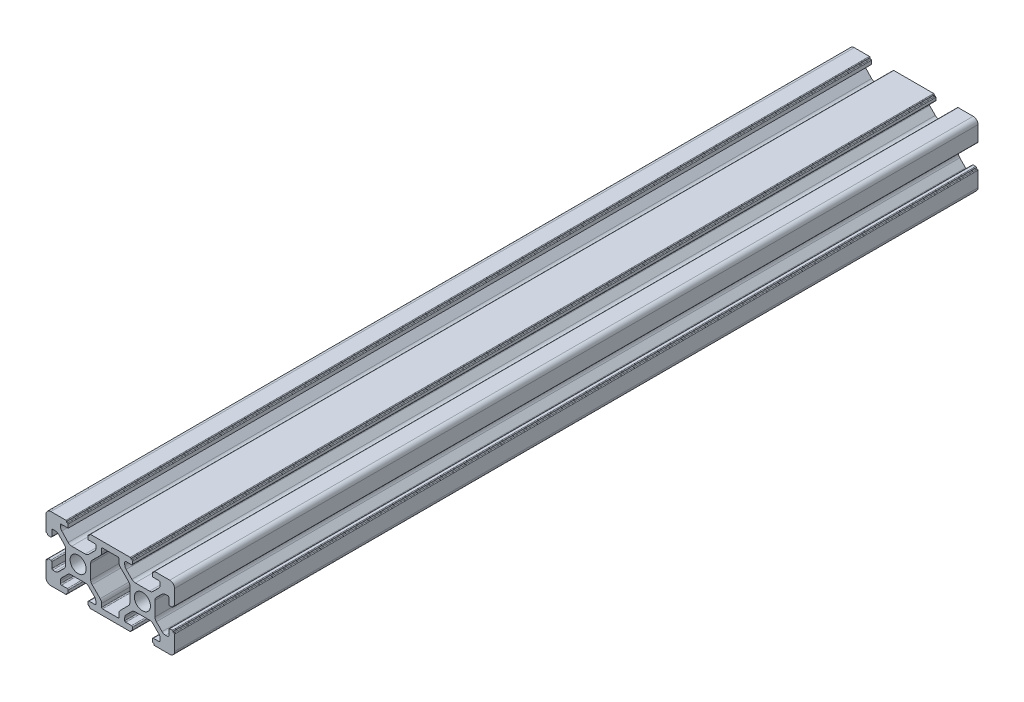
from build123d import *

# Parameters (mm, degrees)
SKETCH1_R           = 2.5
BOSS_EXTRUDE2_DEPTH = 250


with BuildPart() as part:
    # Sketch1 → Boss-Extrude2 (new body)
    with BuildSketch(Plane.XY):
        with BuildLine():
            Line((1.5, 0), (6.2, 0))
            ThreePointArc((6.2, 0), (6.341421356, 0.058578644), (6.4, 0.2))
            Line((6.4, 0.2), (6.4, 0.3))
            ThreePointArc((6.4, 0.3), (6.458578644, 0.441421356), (6.6, 0.5))
            Line((6.6, 0.5), (6.7, 0.5))
            ThreePointArc((6.7, 0.5), (6.841421356, 0.558578644), (6.9, 0.7))
            Line((6.9, 0.7), (6.9, 1.5))
            ThreePointArc((6.9, 1.5), (6.812132034, 1.712132034), (6.6, 1.8))
            Line((6.6, 1.8), (4.8, 1.8))
            ThreePointArc((4.8, 1.8), (4.587867966, 1.887867966), (4.5, 2.1))
            Line((4.5, 2.1), (4.5, 2.818019485))
            ThreePointArc((4.5, 2.818019485), (4.614180701, 3.392044633), (4.939339828, 3.878679656))
            Line((4.939339828, 3.878679656), (6.721320344, 5.660660172))
            ThreePointArc((6.721320344, 5.660660172), (7.207955367, 5.985819299), (7.781980515, 6.1))
            Line((7.781980515, 6.1), (12.218019485, 6.1))
            ThreePointArc((12.218019485, 6.1), (12.792044633, 5.985819299), (13.278679656, 5.660660172))
            Line((13.278679656, 5.660660172), (15.060660172, 3.878679656))
            ThreePointArc((15.060660172, 3.878679656), (15.385819299, 3.392044633), (15.5, 2.818019485))
            Line((15.5, 2.818019485), (15.5, 2.1))
            ThreePointArc((15.5, 2.1), (15.412132034, 1.887867966), (15.2, 1.8))
            Line((15.2, 1.8), (13.4, 1.8))
            ThreePointArc((13.4, 1.8), (13.187867966, 1.712132034), (13.1, 1.5))
            Line((13.1, 1.5), (13.1, 0.7))
            ThreePointArc((13.1, 0.7), (13.158578644, 0.558578644), (13.3, 0.5))
            Line((13.3, 0.5), (13.4, 0.5))
            ThreePointArc((13.4, 0.5), (13.541421356, 0.441421356), (13.6, 0.3))
            Line((13.6, 0.3), (13.6, 0.2))
            ThreePointArc((13.6, 0.2), (13.658578644, 0.058578644), (13.8, 0))
            Line((13.8, 0), (26.2, 0))
            ThreePointArc((26.2, 0), (26.341421356, 0.058578644), (26.4, 0.2))
            Line((26.4, 0.2), (26.4, 0.3))
            ThreePointArc((26.4, 0.3), (26.458578644, 0.441421356), (26.6, 0.5))
            Line((26.6, 0.5), (26.7, 0.5))
            ThreePointArc((26.7, 0.5), (26.841421356, 0.558578644), (26.9, 0.7))
            Line((26.9, 0.7), (26.9, 1.5))
            ThreePointArc((26.9, 1.5), (26.812132034, 1.712132034), (26.6, 1.8))
            Line((26.6, 1.8), (24.8, 1.8))
            ThreePointArc((24.8, 1.8), (24.587867966, 1.887867966), (24.5, 2.1))
            Line((24.5, 2.1), (24.5, 2.818019485))
            ThreePointArc((24.5, 2.818019485), (24.614180701, 3.392044633), (24.939339828, 3.878679656))
            Line((24.939339828, 3.878679656), (26.721320344, 5.660660172))
            ThreePointArc((26.721320344, 5.660660172), (27.207955367, 5.985819299), (27.781980515, 6.1))
            Line((27.781980515, 6.1), (32.218019485, 6.1))
            ThreePointArc((32.218019485, 6.1), (32.792044633, 5.985819299), (33.278679656, 5.660660172))
            Line((33.278679656, 5.660660172), (35.060660172, 3.878679656))
            ThreePointArc((35.060660172, 3.878679656), (35.385819299, 3.392044633), (35.5, 2.818019485))
            Line((35.5, 2.818019485), (35.5, 2.1))
            ThreePointArc((35.5, 2.1), (35.412132034, 1.887867966), (35.2, 1.8))
            Line((35.2, 1.8), (33.4, 1.8))
            ThreePointArc((33.4, 1.8), (33.187867966, 1.712132034), (33.1, 1.5))
            Line((33.1, 1.5), (33.1, 0.7))
            ThreePointArc((33.1, 0.7), (33.158578644, 0.558578644), (33.3, 0.5))
            Line((33.3, 0.5), (33.4, 0.5))
            ThreePointArc((33.4, 0.5), (33.541421356, 0.441421356), (33.6, 0.3))
            Line((33.6, 0.3), (33.6, 0.2))
            ThreePointArc((33.6, 0.2), (33.658578644, 0.058578644), (33.8, 0))
            Line((33.8, 0), (38.5, 0))
            ThreePointArc((38.5, 0), (39.560660172, 0.439339828), (40, 1.5))
            Line((40, 1.5), (40, 6.2))
            ThreePointArc((40, 6.2), (39.941421356, 6.341421356), (39.8, 6.4))
            Line((39.8, 6.4), (39.7, 6.4))
            ThreePointArc((39.7, 6.4), (39.558578644, 6.458578644), (39.5, 6.6))
            Line((39.5, 6.6), (39.5, 6.7))
            ThreePointArc((39.5, 6.7), (39.441421356, 6.841421356), (39.3, 6.9))
            Line((39.3, 6.9), (38.5, 6.9))
            ThreePointArc((38.5, 6.9), (38.287867966, 6.812132034), (38.2, 6.6))
            Line((38.2, 6.6), (38.2, 4.8))
            ThreePointArc((38.2, 4.8), (38.112132034, 4.587867966), (37.9, 4.5))
            Line((37.9, 4.5), (37.181980515, 4.5))
            ThreePointArc((37.181980515, 4.5), (36.607955367, 4.614180701), (36.121320344, 4.939339828))
            Line((36.121320344, 4.939339828), (34.339339828, 6.721320344))
            ThreePointArc((34.339339828, 6.721320344), (34.014180701, 7.207955367), (33.9, 7.781980515))
            Line((33.9, 7.781980515), (33.9, 12.218019485))
            ThreePointArc((33.9, 12.218019485), (34.014180701, 12.792044633), (34.339339828, 13.278679656))
            Line((34.339339828, 13.278679656), (36.121320344, 15.060660172))
            ThreePointArc((36.121320344, 15.060660172), (36.607955367, 15.385819299), (37.181980515, 15.5))
            Line((37.181980515, 15.5), (37.9, 15.5))
            ThreePointArc((37.9, 15.5), (38.112132034, 15.412132034), (38.2, 15.2))
            Line((38.2, 15.2), (38.2, 13.4))
            ThreePointArc((38.2, 13.4), (38.287867966, 13.187867966), (38.5, 13.1))
            Line((38.5, 13.1), (39.3, 13.1))
            ThreePointArc((39.3, 13.1), (39.441421356, 13.158578644), (39.5, 13.3))
            Line((39.5, 13.3), (39.5, 13.4))
            ThreePointArc((39.5, 13.4), (39.558578644, 13.541421356), (39.7, 13.6))
            Line((39.7, 13.6), (39.8, 13.6))
            ThreePointArc((39.8, 13.6), (39.941421356, 13.658578644), (40, 13.8))
            Line((40, 13.8), (40, 18.5))
            ThreePointArc((40, 18.5), (39.560660172, 19.560660172), (38.5, 20))
            Line((38.5, 20), (33.8, 20))
            ThreePointArc((33.8, 20), (33.658578644, 19.941421356), (33.6, 19.8))
            Line((33.6, 19.8), (33.6, 19.7))
            ThreePointArc((33.6, 19.7), (33.541421356, 19.558578644), (33.4, 19.5))
            Line((33.4, 19.5), (33.3, 19.5))
            ThreePointArc((33.3, 19.5), (33.158578644, 19.441421356), (33.1, 19.3))
            Line((33.1, 19.3), (33.1, 18.5))
            ThreePointArc((33.1, 18.5), (33.187867966, 18.287867966), (33.4, 18.2))
            Line((33.4, 18.2), (35.2, 18.2))
            ThreePointArc((35.2, 18.2), (35.412132034, 18.112132034), (35.5, 17.9))
            Line((35.5, 17.9), (35.5, 17.181980515))
            ThreePointArc((35.5, 17.181980515), (35.385819299, 16.607955367), (35.060660172, 16.121320344))
            Line((35.060660172, 16.121320344), (33.278679656, 14.339339828))
            ThreePointArc((33.278679656, 14.339339828), (32.792044633, 14.014180701), (32.218019485, 13.9))
            Line((32.218019485, 13.9), (27.781980515, 13.9))
            ThreePointArc((27.781980515, 13.9), (27.207955367, 14.014180701), (26.721320344, 14.339339828))
            Line((26.721320344, 14.339339828), (24.939339828, 16.121320344))
            ThreePointArc((24.939339828, 16.121320344), (24.614180701, 16.607955367), (24.5, 17.181980515))
            Line((24.5, 17.181980515), (24.5, 17.9))
            ThreePointArc((24.5, 17.9), (24.587867966, 18.112132034), (24.8, 18.2))
            Line((24.8, 18.2), (26.6, 18.2))
            ThreePointArc((26.6, 18.2), (26.812132034, 18.287867966), (26.9, 18.5))
            Line((26.9, 18.5), (26.9, 19.3))
            ThreePointArc((26.9, 19.3), (26.841421356, 19.441421356), (26.7, 19.5))
            Line((26.7, 19.5), (26.6, 19.5))
            ThreePointArc((26.6, 19.5), (26.458578644, 19.558578644), (26.4, 19.7))
            Line((26.4, 19.7), (26.4, 19.8))
            ThreePointArc((26.4, 19.8), (26.341421356, 19.941421356), (26.2, 20))
            Line((26.2, 20), (13.8, 20))
            ThreePointArc((13.8, 20), (13.658578644, 19.941421356), (13.6, 19.8))
            Line((13.6, 19.8), (13.6, 19.7))
            ThreePointArc((13.6, 19.7), (13.541421356, 19.558578644), (13.4, 19.5))
            Line((13.4, 19.5), (13.3, 19.5))
            ThreePointArc((13.3, 19.5), (13.158578644, 19.441421356), (13.1, 19.3))
            Line((13.1, 19.3), (13.1, 18.2))
            Line((13.1, 18.2), (15.3, 18.2))
            ThreePointArc((15.3, 18.2), (15.512132034, 18.112132034), (15.6, 17.9))
            Line((15.6, 17.9), (15.6, 17.281980515))
            ThreePointArc((15.6, 17.281980515), (15.485819299, 16.707955367), (15.160660172, 16.221320344))
            Line((15.160660172, 16.221320344), (13.278679656, 14.339339828))
            ThreePointArc((13.278679656, 14.339339828), (12.792044633, 14.014180701), (12.218019485, 13.9))
            Line((12.218019485, 13.9), (7.986375635, 13.9))
            ThreePointArc((7.986375635, 13.9), (7.393381044, 14.022191082), (6.896997987, 14.36885678))
            Line((6.896997987, 14.36885678), (4.910622352, 16.467414163))
            ThreePointArc((4.910622352, 16.467414163), (4.606431474, 16.943609851), (4.5, 17.498557383))
            Line((4.5, 17.498557383), (4.5, 17.9))
            ThreePointArc((4.5, 17.9), (4.587867966, 18.112132034), (4.8, 18.2))
            Line((4.8, 18.2), (6.9, 18.2))
            Line((6.9, 18.2), (6.9, 19.3))
            ThreePointArc((6.9, 19.3), (6.841421356, 19.441421356), (6.7, 19.5))
            Line((6.7, 19.5), (6.6, 19.5))
            ThreePointArc((6.6, 19.5), (6.458578644, 19.558578644), (6.4, 19.7))
            Line((6.4, 19.7), (6.4, 19.8))
            ThreePointArc((6.4, 19.8), (6.341421356, 19.941421356), (6.2, 20))
            Line((6.2, 20), (1.5, 20))
            ThreePointArc((1.5, 20), (0.439339828, 19.560660172), (0, 18.5))
            Line((0, 18.5), (0, 13.8))
            ThreePointArc((0, 13.8), (0.058578644, 13.658578644), (0.2, 13.6))
            Line((0.2, 13.6), (0.3, 13.6))
            ThreePointArc((0.3, 13.6), (0.441421356, 13.541421356), (0.5, 13.4))
            Line((0.5, 13.4), (0.5, 13.3))
            ThreePointArc((0.5, 13.3), (0.558578644, 13.158578644), (0.7, 13.1))
            Line((0.7, 13.1), (1.5, 13.1))
            ThreePointArc((1.5, 13.1), (1.712132034, 13.187867966), (1.8, 13.4))
            Line((1.8, 13.4), (1.8, 15.2))
            ThreePointArc((1.8, 15.2), (1.887867966, 15.412132034), (2.1, 15.5))
            Line((2.1, 15.5), (2.818019485, 15.5))
            ThreePointArc((2.818019485, 15.5), (3.392044633, 15.385819299), (3.878679656, 15.060660172))
            Line((3.878679656, 15.060660172), (5.660660172, 13.278679656))
            ThreePointArc((5.660660172, 13.278679656), (5.985819299, 12.792044633), (6.1, 12.218019485))
            Line((6.1, 12.218019485), (6.1, 7.781980515))
            ThreePointArc((6.1, 7.781980515), (5.985819299, 7.207955367), (5.660660172, 6.721320344))
            Line((5.660660172, 6.721320344), (3.878679656, 4.939339828))
            ThreePointArc((3.878679656, 4.939339828), (3.392044633, 4.614180701), (2.818019485, 4.5))
            Line((2.818019485, 4.5), (2.1, 4.5))
            ThreePointArc((2.1, 4.5), (1.887867966, 4.587867966), (1.8, 4.8))
            Line((1.8, 4.8), (1.8, 6.6))
            ThreePointArc((1.8, 6.6), (1.712132034, 6.812132034), (1.5, 6.9))
            Line((1.5, 6.9), (0.7, 6.9))
            ThreePointArc((0.7, 6.9), (0.558578644, 6.841421356), (0.5, 6.7))
            Line((0.5, 6.7), (0.5, 6.6))
            ThreePointArc((0.5, 6.6), (0.441421356, 6.458578644), (0.3, 6.4))
            Line((0.3, 6.4), (0.2, 6.4))
            ThreePointArc((0.2, 6.4), (0.058578644, 6.341421356), (0, 6.2))
            Line((0, 6.2), (0, 1.5))
            ThreePointArc((0, 1.5), (0.439339828, 0.439339828), (1.5, 0))
        make_face()
        with Locations((10, 10)):
            Circle(SKETCH1_R, mode=Mode.SUBTRACT)
        with Locations((30, 10)):
            Circle(SKETCH1_R, mode=Mode.SUBTRACT)
        with BuildLine():
            Line((17.6, 1.8), (22.4, 1.8))
            ThreePointArc((22.4, 1.8), (22.612132034, 1.887867966), (22.7, 2.1))
            Line((22.7, 2.1), (22.7, 3.139339828))
            ThreePointArc((22.7, 3.139339828), (22.814180701, 3.713364977), (23.139339828, 4.2))
            Line((23.139339828, 4.2), (25.660660172, 6.721320344))
            ThreePointArc((25.660660172, 6.721320344), (25.985819299, 7.207955367), (26.1, 7.781980515))
            Line((26.1, 7.781980515), (26.1, 12.218019485))
            ThreePointArc((26.1, 12.218019485), (25.985819299, 12.792044633), (25.660660172, 13.278679656))
            Line((25.660660172, 13.278679656), (23.139339828, 15.8))
            ThreePointArc((23.139339828, 15.8), (22.814180701, 16.286635023), (22.7, 16.860660172))
            Line((22.7, 16.860660172), (22.7, 17.9))
            ThreePointArc((22.7, 17.9), (22.612132034, 18.112132034), (22.4, 18.2))
            Line((22.4, 18.2), (17.6, 18.2))
            ThreePointArc((17.6, 18.2), (17.387867966, 18.112132034), (17.3, 17.9))
            Line((17.3, 17.9), (17.3, 16.860660172))
            ThreePointArc((17.3, 16.860660172), (17.185819299, 16.286635023), (16.860660172, 15.8))
            Line((16.860660172, 15.8), (14.339339828, 13.278679656))
            ThreePointArc((14.339339828, 13.278679656), (14.014180701, 12.792044633), (13.9, 12.218019485))
            Line((13.9, 12.218019485), (13.9, 7.781980515))
            ThreePointArc((13.9, 7.781980515), (14.014180701, 7.207955367), (14.339339828, 6.721320344))
            Line((14.339339828, 6.721320344), (16.860660172, 4.2))
            ThreePointArc((16.860660172, 4.2), (17.185819299, 3.713364977), (17.3, 3.139339828))
            Line((17.3, 3.139339828), (17.3, 2.1))
            ThreePointArc((17.3, 2.1), (17.387867966, 1.887867966), (17.6, 1.8))
        make_face(mode=Mode.SUBTRACT)
    extrude(amount=BOSS_EXTRUDE2_DEPTH)


solid = part.part
